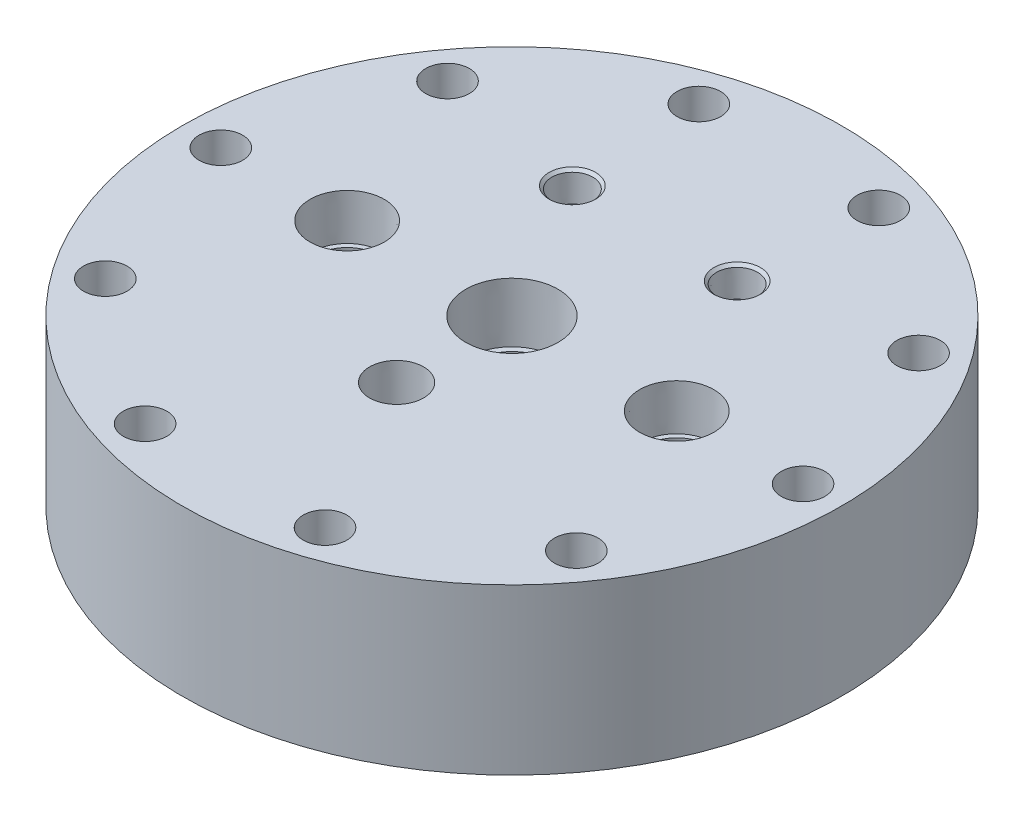
from build123d import *

# Parameters (mm, degrees)
F_3_8_NPT_TAPPED_HOLE1_AT_2_COUNT = 2
F_3_8_NPT_TAPPED_HOLE1_AT_2_PITCH = 76.2
F_3_8_CLEARANCE_HOLE2_D           = 10.0838
CIRPATTERN1_COUNT                 = 10
F_1_8_NPT_TAPPED_HOLE2_AT_2_COUNT = 2
F_1_8_NPT_TAPPED_HOLE2_AT_2_PITCH = 38.1
SKETCH15_R                        = 3.175
CUT_EXTRUDE1_DEPTH                = 12.7


with BuildPart() as part:
    # Sketch1 → Revolve1 (revolve)
    with BuildSketch(Plane.XY):
        Polygon((0, 0), (-76.2, 0), (-76.2, -38.1), (-60.96, -38.1), (-60.96, -25.4), (-57.563361296, -25.4), (-57.563361296, -22.865513246), (-52.667748855, -22.865513246), (-52.667748855, -25.4), (-32.163982831, -25.4), (-30.364664072, -25.4), (-28.575, -25.4), (-28.575, -20.32), (-27.359482971, -20.32), (-27.359482971, -18.0238967), (-24.714766805, -18.0238967), (-24.714766805, -20.32), (-22.225, -20.32), (0, -15.85722), align=None)
    revolve(axis=Axis((0, 0, 0), (0, -1, 0)))

    # Sketch3 → 1/2 NPT Tapped Hole1 (revolve, cut)
    with BuildSketch(Plane(origin=(0, 0, 0), x_dir=(0, 0, 1), z_dir=(1, 0, 0))):
        Polygon((0, 0), (0, 38.1), (8.9281, 38.1), (8.9281, 13.462), (10.261665792, 13.462), (10.6647361, 0), align=None)
    revolve(axis=Axis((0, 6.35, 0), (0, -1, 0)), mode=Mode.SUBTRACT)

    # Sketch5 → 3/8 NPT Tapped Hole1 (revolve, cut)
    with BuildSketch(Plane(origin=(-38.1, 0, 0), x_dir=(0, 0, 1), z_dir=(1, 0, 0))):
        Polygon((0, 0), (0, 38.1), (7.1374, 38.1), (7.1374, 10.414), (8.263205494, 10.414), (8.5750146, 0), align=None)
    f_3_8_npt_tapped_hole1 = revolve(axis=Axis((-38.1, 6.35, 0), (0, -1, 0)), mode=Mode.SUBTRACT)

    # 3/8 NPT Tapped Hole1 at 2: 3/8 NPT Tapped Hole1 ×2
    with Locations(*[(i * F_3_8_NPT_TAPPED_HOLE1_AT_2_PITCH, 0, 0) for i in range(1, F_3_8_NPT_TAPPED_HOLE1_AT_2_COUNT)]):
        add(f_3_8_npt_tapped_hole1, mode=Mode.SUBTRACT)

    # 3/8 Clearance Hole2 (through all)
    with Locations(Plane(origin=(67.31, 0, 0), x_dir=(1, 0, 0), z_dir=(0, 1, 0))):
        with Locations((0, 0)):
            f_3_8_clearance_hole2 = Hole(F_3_8_CLEARANCE_HOLE2_D / 2)

    # CirPattern1: 3/8 Clearance Hole2 ×10 about axis
    cirpattern1_axis = Axis((0, 0, 0), (0, 1, 0))
    for i in range(1, CIRPATTERN1_COUNT):
        add(f_3_8_clearance_hole2.rotate(cirpattern1_axis, i * 360 / CIRPATTERN1_COUNT), mode=Mode.SUBTRACT)

    # Sketch7 → 1/8 NPT Tapped Hole2 (revolve, cut)
    with BuildSketch(Plane(origin=(-19.05, 0, -33.02), x_dir=(0, 0, 1), z_dir=(1, 0, 0))):
        Polygon((0, 0), (0, 38.1), (4.2164, 38.1), (4.2164, 6.858), (4.556413846, 6.858), (4.7427388, 0.635), (5.3777388, 0), align=None)
    f_1_8_npt_tapped_hole2 = revolve(axis=Axis((-19.05, 6.35, -33.02), (0, -1, 0)), mode=Mode.SUBTRACT)

    # 1/8 NPT Tapped Hole2 at 2: 1/8 NPT Tapped Hole2 ×2
    with Locations(*[(i * F_1_8_NPT_TAPPED_HOLE2_AT_2_PITCH, 0, 0) for i in range(1, F_1_8_NPT_TAPPED_HOLE2_AT_2_COUNT)]):
        add(f_1_8_npt_tapped_hole2, mode=Mode.SUBTRACT)

    # Sketch15 → Cut-Extrude1 (cut, symmetric)
    with BuildSketch(Plane(origin=(0, -0.843551224, -0.843551224), x_dir=(0, 0.707106781186549, -0.7071067811865461), z_dir=(0, -0.7071067811865461, -0.707106781186549))):
        with Locations((-25.322961582, 0)):
            Circle(SKETCH15_R)
    extrude(amount=CUT_EXTRUDE1_DEPTH, both=True, mode=Mode.SUBTRACT)

    # Sketch12 → 1/4 NPT Tapped Hole1 (revolve, cut)
    with BuildSketch(Plane(origin=(0, 0, 26.67), x_dir=(0, 0, 1), z_dir=(1, 0, 0))):
        Polygon((0, 0), (0, 16.51), (5.5626, 13.167652721), (5.5626, 9.906), (5.943685794, 9.906), (6.2402847, 0), align=None)
    revolve(axis=Axis((0, 6.35, 26.67), (0, -1, 0)), mode=Mode.SUBTRACT)


solid = part.part
